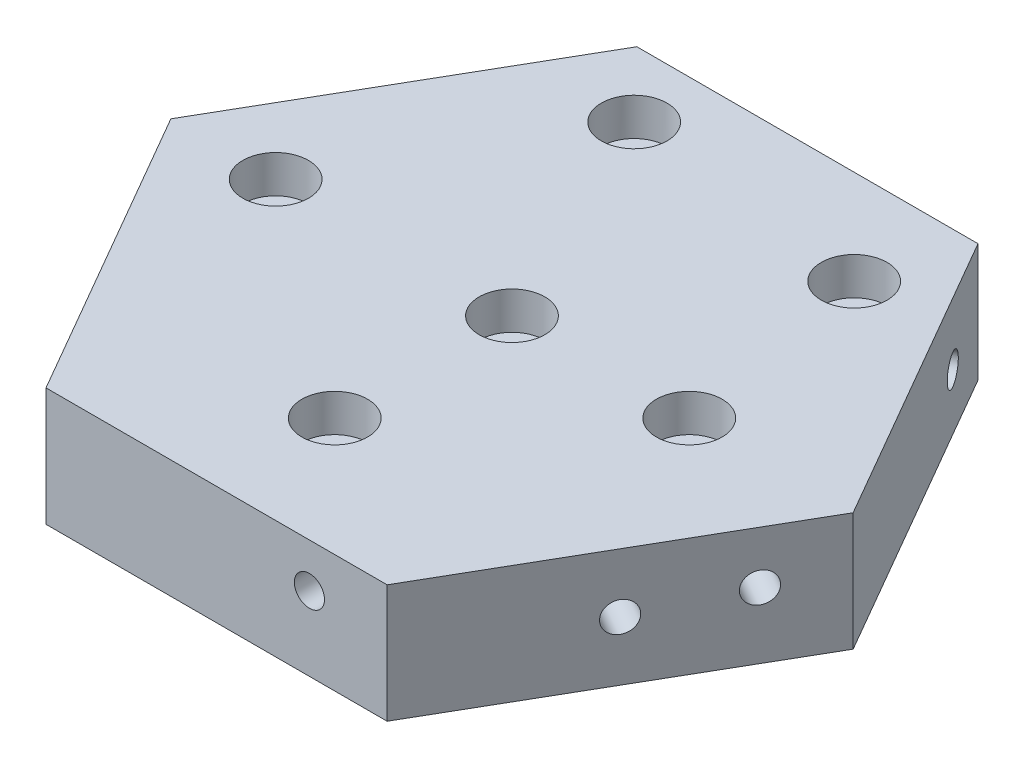
from build123d import *

# Parameters (mm, degrees)
BOSS_EXTRUDE1_DEPTH                              = 10
CBORE_FOR_1_4_SOCKET_HEAD_CAP_SCREW1_D           = 6.5278
CBORE_FOR_1_4_SOCKET_HEAD_CAP_SCREW1_CBORE_D     = 11.1125
CBORE_FOR_1_4_SOCKET_HEAD_CAP_SCREW1_CBORE_DEPTH = 6.35
F_1_4_20_TAPPED_HOLE1_D                          = 5.1054
F_1_4_20_TAPPED_HOLE1_DEPTH                      = 16.51
F_1_4_20_TAPPED_HOLE1_TIP                        = 1.533816902
F_1_4_20_TAPPED_HOLE1_ON_FACE_2_D                = 5.1054
F_1_4_20_TAPPED_HOLE1_ON_FACE_2_DEPTH            = 16.51
F_1_4_20_TAPPED_HOLE1_ON_FACE_2_TIP              = 1.533816902
F_1_4_20_TAPPED_HOLE1_ON_FACE_3_D                = 5.1054
F_1_4_20_TAPPED_HOLE1_ON_FACE_3_DEPTH            = 16.51
F_1_4_20_TAPPED_HOLE1_ON_FACE_3_TIP              = 1.533816902
F_1_4_20_TAPPED_HOLE1_ON_FACE_4_D                = 5.1054
F_1_4_20_TAPPED_HOLE1_ON_FACE_4_DEPTH            = 16.51
F_1_4_20_TAPPED_HOLE1_ON_FACE_4_TIP              = 1.533816902
F_1_4_20_TAPPED_HOLE1_ON_FACE_5_D                = 5.1054
F_1_4_20_TAPPED_HOLE1_ON_FACE_5_DEPTH            = 16.51
F_1_4_20_TAPPED_HOLE1_ON_FACE_5_TIP              = 1.533816902
F_1_4_20_TAPPED_HOLE1_ON_FACE_6_D                = 5.1054
F_1_4_20_TAPPED_HOLE1_ON_FACE_6_DEPTH            = 16.51
F_1_4_20_TAPPED_HOLE1_ON_FACE_6_TIP              = 1.533816902


with BuildPart() as part:
    # Sketch1 → Boss-Extrude1 (new, symmetric)
    with BuildSketch(Plane(origin=(0, 0, 0), x_dir=(1, 0, 0), z_dir=(0, 1, 0))):
        Polygon((28.867513459, 50), (-28.867513459, 50), (-57.735026919, 0), (-28.867513459, -50), (28.867513459, -50), (57.735026919, 0), align=None)
    extrude(amount=BOSS_EXTRUDE1_DEPTH, both=True)

    # CBORE for 1/4 Socket Head Cap Screw1 (through all)
    with Locations(Plane(origin=(0, 10, 0), x_dir=(1, 0, 0), z_dir=(0, 1, 0))):
        with Locations((-18.063835143, 38.73885736), (23.90103382, 34.011647758), (30, 0), (0, -30), (0, 0), (-40, 0)):
            CounterBoreHole(CBORE_FOR_1_4_SOCKET_HEAD_CAP_SCREW1_D / 2, CBORE_FOR_1_4_SOCKET_HEAD_CAP_SCREW1_CBORE_D / 2, CBORE_FOR_1_4_SOCKET_HEAD_CAP_SCREW1_CBORE_DEPTH)

    # 1/4-20 Tapped Hole1
    with Locations(Plane(origin=(15.715947598, 2.535750011, 50), x_dir=(1, 0, 0), z_dir=(0, 0, 1))):
        with Locations((0, 0)):
            Hole(F_1_4_20_TAPPED_HOLE1_D / 2, depth=F_1_4_20_TAPPED_HOLE1_DEPTH)
            with Locations((0, 0, -(F_1_4_20_TAPPED_HOLE1_DEPTH + F_1_4_20_TAPPED_HOLE1_TIP / 2))):  # 118° drill point
                Cone(0, F_1_4_20_TAPPED_HOLE1_D / 2, F_1_4_20_TAPPED_HOLE1_TIP, mode=Mode.SUBTRACT)

    # 1/4-20 Tapped Hole1 on face 2
    with Locations(Plane(origin=(51.96523665, 1.147122247, 9.993569894), x_dir=(-0.500000174844, 0, 0.866025302838), z_dir=(0.866025302838, 0, 0.500000174844))):
        with Locations((0, 0)):
            Hole(F_1_4_20_TAPPED_HOLE1_ON_FACE_2_D / 2, depth=F_1_4_20_TAPPED_HOLE1_ON_FACE_2_DEPTH)
            with Locations((0, 0, -(F_1_4_20_TAPPED_HOLE1_ON_FACE_2_DEPTH + F_1_4_20_TAPPED_HOLE1_ON_FACE_2_TIP / 2))):  # 118° drill point
                Cone(0, F_1_4_20_TAPPED_HOLE1_ON_FACE_2_D / 2, F_1_4_20_TAPPED_HOLE1_ON_FACE_2_TIP, mode=Mode.SUBTRACT)

    # 1/4-20 Tapped Hole1 on face 3
    with Locations(Plane(origin=(34.700967426, -0.4984297, -39.896161346), x_dir=(0.500000174844, 0, 0.866025302838), z_dir=(0.866025302838, 0, -0.500000174844))):
        with Locations((0, 0)):
            Hole(F_1_4_20_TAPPED_HOLE1_ON_FACE_3_D / 2, depth=F_1_4_20_TAPPED_HOLE1_ON_FACE_3_DEPTH)
            with Locations((0, 0, -(F_1_4_20_TAPPED_HOLE1_ON_FACE_3_DEPTH + F_1_4_20_TAPPED_HOLE1_ON_FACE_3_TIP / 2))):  # 118° drill point
                Cone(0, F_1_4_20_TAPPED_HOLE1_ON_FACE_3_D / 2, F_1_4_20_TAPPED_HOLE1_ON_FACE_3_TIP, mode=Mode.SUBTRACT)

    # 1/4-20 Tapped Hole1 on face 4
    with Locations(Plane(origin=(-14.951666728, 3.122142206, -50), x_dir=(-1, 0, 0), z_dir=(0, 0, -1))):
        with Locations((0, 0)):
            Hole(F_1_4_20_TAPPED_HOLE1_ON_FACE_4_D / 2, depth=F_1_4_20_TAPPED_HOLE1_ON_FACE_4_DEPTH)
            with Locations((0, 0, -(F_1_4_20_TAPPED_HOLE1_ON_FACE_4_DEPTH + F_1_4_20_TAPPED_HOLE1_ON_FACE_4_TIP / 2))):  # 118° drill point
                Cone(0, F_1_4_20_TAPPED_HOLE1_ON_FACE_4_D / 2, F_1_4_20_TAPPED_HOLE1_ON_FACE_4_TIP, mode=Mode.SUBTRACT)

    # 1/4-20 Tapped Hole1 on face 5
    with Locations(Plane(origin=(-47.385150645, 1.279331541, -17.926511558), x_dir=(0.500000174844, 0, -0.866025302838), z_dir=(-0.866025302838, 0, -0.500000174844))):
        with Locations((0, 0)):
            Hole(F_1_4_20_TAPPED_HOLE1_ON_FACE_5_D / 2, depth=F_1_4_20_TAPPED_HOLE1_ON_FACE_5_DEPTH)
            with Locations((0, 0, -(F_1_4_20_TAPPED_HOLE1_ON_FACE_5_DEPTH + F_1_4_20_TAPPED_HOLE1_ON_FACE_5_TIP / 2))):  # 118° drill point
                Cone(0, F_1_4_20_TAPPED_HOLE1_ON_FACE_5_D / 2, F_1_4_20_TAPPED_HOLE1_ON_FACE_5_TIP, mode=Mode.SUBTRACT)

    # 1/4-20 Tapped Hole1 on face 6
    with Locations(Plane(origin=(43.301270189, 0, 25), x_dir=(-0.500000174844, 0, 0.866025302838), z_dir=(0.866025302838, 0, 0.500000174844))):
        with Locations((0, 0)):
            Hole(F_1_4_20_TAPPED_HOLE1_ON_FACE_6_D / 2, depth=F_1_4_20_TAPPED_HOLE1_ON_FACE_6_DEPTH)
            with Locations((0, 0, -(F_1_4_20_TAPPED_HOLE1_ON_FACE_6_DEPTH + F_1_4_20_TAPPED_HOLE1_ON_FACE_6_TIP / 2))):  # 118° drill point
                Cone(0, F_1_4_20_TAPPED_HOLE1_ON_FACE_6_D / 2, F_1_4_20_TAPPED_HOLE1_ON_FACE_6_TIP, mode=Mode.SUBTRACT)


solid = part.part
